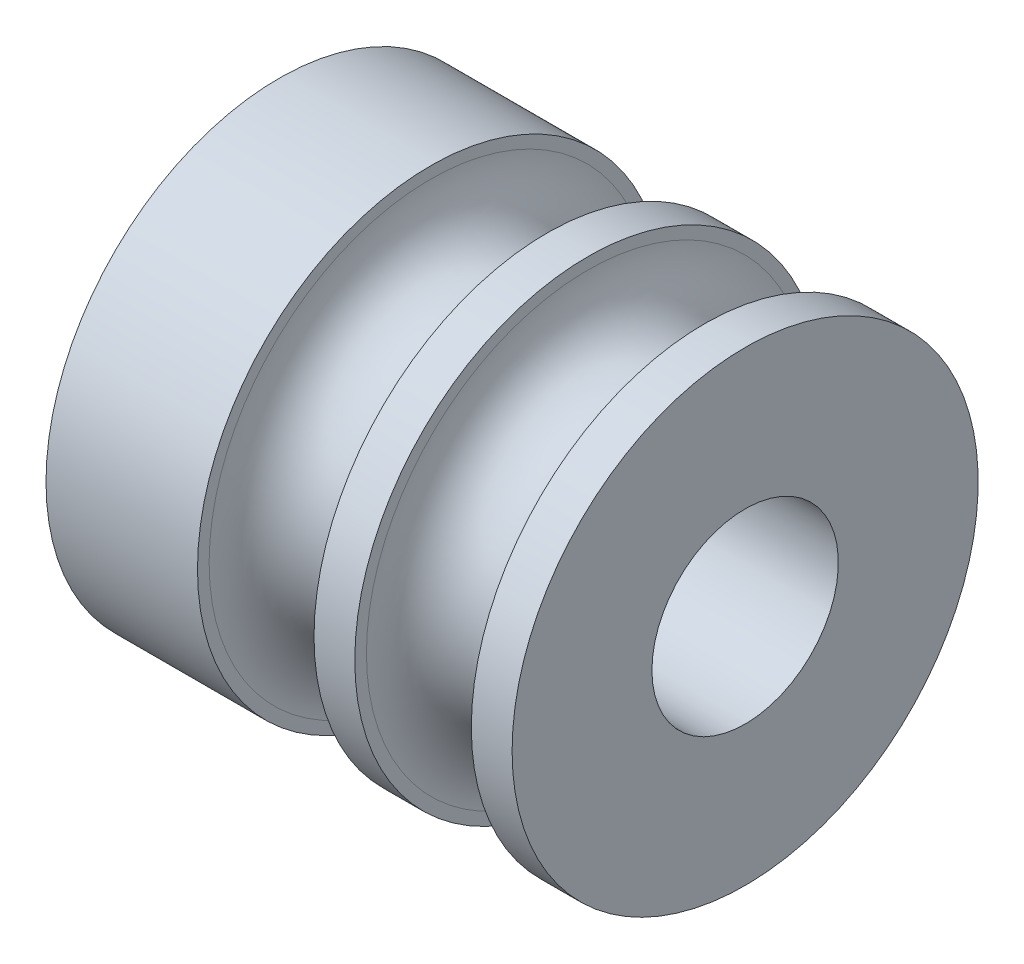
from build123d import *


with BuildPart() as part:
    # Sketch1 → Revolve1 (revolve)
    with BuildSketch(Plane(origin=(0, 0, 0), x_dir=(1, 0, 0), z_dir=(0, 1, 0)), mode=Mode.PRIVATE) as revolve1_sk:
        with BuildLine():
            Line((-3.5, 10), (-3.5, 9.5))
            ThreePointArc((-3.5, 9.5), (-1, 7), (1.5, 9.5))
            Line((1.5, 9.5), (1.5, 10))
            Line((1.5, 10), (3.25, 10))
            Line((3.25, 10), (3.25, 9.5))
            ThreePointArc((3.25, 9.5), (5.75, 7), (8.25, 9.5))
            Line((8.25, 9.5), (8.25, 10))
            Line((8.25, 10), (10, 10))
            Line((10, 10), (10, 4))
            Line((10, 4), (-10, 4))
            Line((-10, 4), (-10, 10))
            Line((-10, 10), (-3.5, 10))
        make_face()
    revolve(revolve1_sk.sketch.rotate(Axis((-17.222797871, 0, 0), (1, 0, 0)), 180), axis=Axis((-17.222797871, 0, 0), (1, 0, 0)))


solid = part.part
